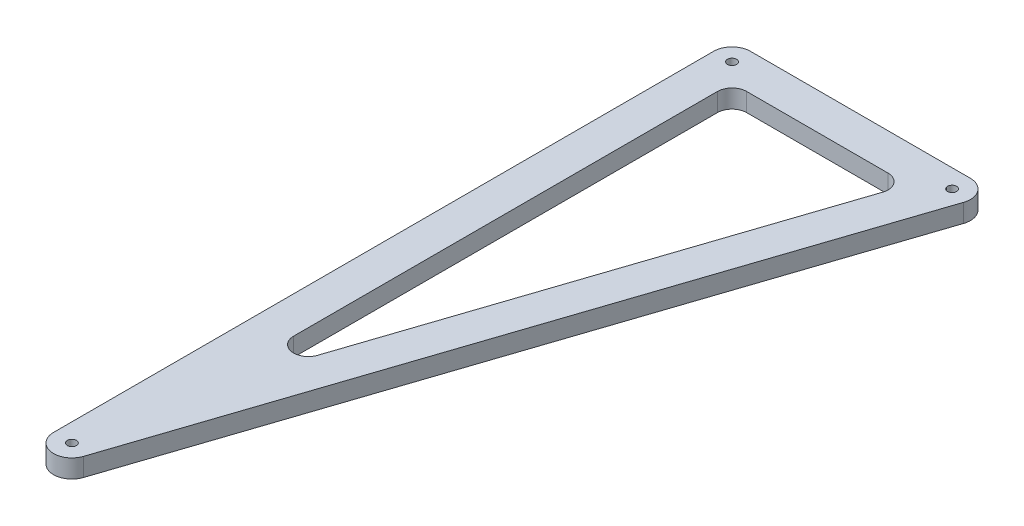
from build123d import *

# Parameters (mm, degrees)
SKETCH1_R           = 0.7874
BOSS_EXTRUDE1_DEPTH = 3.175


with BuildPart() as part:
    # Sketch1 → Boss-Extrude1 (new body)
    with BuildSketch(Plane(origin=(0, 0, 0), x_dir=(1, 0, 0), z_dir=(0, 1, 0))):
        with BuildLine():
            Line((-3.175, 0), (-3.175, 114.3))
            ThreePointArc((-3.175, 114.3), (-2.24506403, 116.54506403), (0, 117.475))
            Line((0, 117.475), (38.1, 117.475))
            ThreePointArc((38.1, 117.475), (40.675693938, 116.156455154), (41.112069471, 113.295976843))
            Line((41.112069471, 113.295976843), (3.012069471, -1.004023157))
            ThreePointArc((3.012069471, -1.004023157), (-0.508578622, -3.134002678), (-3.175, 0))
        make_face()
        with Locations(Location((0, 0, 0), (0, 0, 270))):
            Circle(SKETCH1_R, mode=Mode.SUBTRACT)
        with Locations(Location((0, 114.3, 0), (0, 0, 270))):
            Circle(SKETCH1_R, mode=Mode.SUBTRACT)
        with Locations(Location((38.1, 114.3, 0), (0, 0, 270))):
            Circle(SKETCH1_R, mode=Mode.SUBTRACT)
        with BuildLine():
            Line((3.175, 108.585), (3.175, 35.217416828))
            ThreePointArc((3.175, 35.217416828), (5.308137103, 32.710214685), (8.124655577, 34.414198302))
            Line((8.124655577, 34.414198302), (32.580516634, 107.781781474))
            ThreePointArc((32.580516634, 107.781781474), (32.231416208, 110.070164123), (30.170861057, 111.125))
            Line((30.170861057, 111.125), (5.715, 111.125))
            ThreePointArc((5.715, 111.125), (3.918948776, 110.381051224), (3.175, 108.585))
        make_face(mode=Mode.SUBTRACT)
    extrude(amount=BOSS_EXTRUDE1_DEPTH)


solid = part.part
